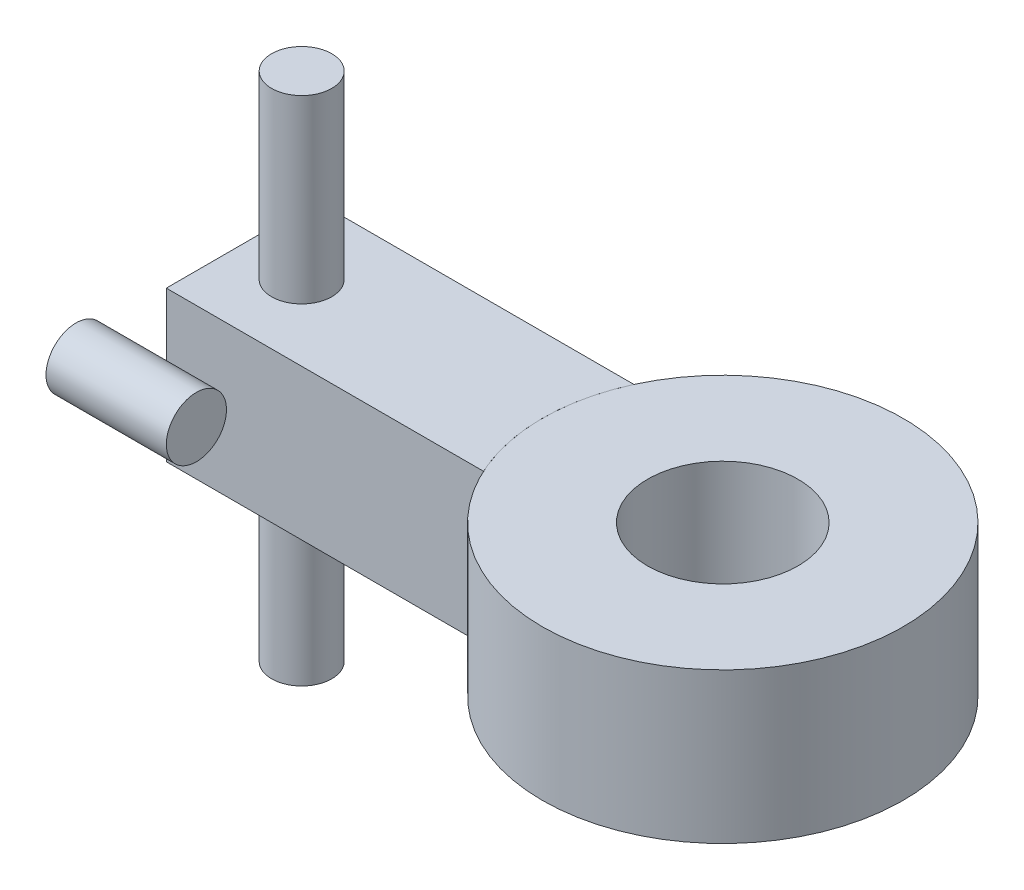
from build123d import *

# Parameters (mm, degrees)
SKETCH1_R                            = 30
SKETCH1_R_2                          = 12.5
BOSS_EXTRUDE1_DEPTH                  = 25
SKETCH3_W                            = 25
SKETCH3_H                            = 25
BOSS_EXTRUDE2_DEPTH                  = 50
BOSS_EXTRUDE2_DIRECTION_2_REACH      = 73.589
BOSS_EXTRUDE2_DIRECTION_2_END_RADIUS = 30
BOSS_EXTRUDE3_DEPTH                  = 30
BOSS_EXTRUDE3_DEPTH_BACK             = 55
SKETCH4_R                            = 5
BOSS_EXTRUDE4_DEPTH                  = 10
BOSS_EXTRUDE4_DEPTH_BACK             = 10
SKETCH5_R                            = 5


with BuildPart() as part:
    # Sketch1 → Boss-Extrude1 (new body)
    with BuildSketch(Plane(origin=(0, 0, 0), x_dir=(1, 0, 0), z_dir=(0, 1, 0))):
        Circle(SKETCH1_R)
        Circle(SKETCH1_R_2, mode=Mode.SUBTRACT)
    extrude(amount=BOSS_EXTRUDE1_DEPTH)


with BuildPart() as body_2:
    # Sketch3 → Boss-Extrude2 (new body)
    with BuildSketch(Plane.ZY.offset(30)):
        with Locations((0, 12.5)):
            Rectangle(SKETCH3_W, SKETCH3_H)
    extrude(amount=BOSS_EXTRUDE2_DEPTH)

    # Boss-Extrude2 direction 2: up to this cylinder (the profile starts outside it)
    boss_extrude2_direction_2_end = Plane(origin=(0, 12.5, 0), z_dir=(0, -1, 0)) * Cylinder(BOSS_EXTRUDE2_DIRECTION_2_END_RADIUS, 208.178, mode=Mode.PRIVATE)
    # Sketch3 → Boss-Extrude2 direction 2 (add, up to the surface)
    with BuildSketch(Plane.ZY.offset(30), mode=Mode.PRIVATE) as boss_extrude2_direction_2_sk1:
        with Locations((0, 12.5)):
            Rectangle(SKETCH3_W, SKETCH3_H)
    boss_extrude2_direction_2_tool1 = extrude(boss_extrude2_direction_2_sk1.sketch, amount=-BOSS_EXTRUDE2_DIRECTION_2_REACH, mode=Mode.PRIVATE) - boss_extrude2_direction_2_end
    add(boss_extrude2_direction_2_tool1.solids().sort_by_distance((-30, 12.5, 0))[0])
    add(boss_extrude2_direction_2_tool1.solids().sort_by_distance((-30, 12.5, 0))[1])

    # Sketch4 → Boss-Extrude3 (add, two sides: drawn at the far end of the back side and taken through both)
    with BuildSketch(Plane.XZ.offset(-BOSS_EXTRUDE3_DEPTH_BACK)):
        with Locations((-70, 0)):
            Circle(SKETCH4_R)
    extrude(amount=BOSS_EXTRUDE3_DEPTH + BOSS_EXTRUDE3_DEPTH_BACK)


with BuildPart() as body_3:
    # Sketch5 → Boss-Extrude4 (new, two sides: drawn at the far end of the back side and taken through both)
    with BuildSketch(Plane.ZY.offset(80).offset(-BOSS_EXTRUDE4_DEPTH_BACK)):
        with Locations((17.5, 12.5)):
            Circle(SKETCH5_R)
    extrude(amount=BOSS_EXTRUDE4_DEPTH + BOSS_EXTRUDE4_DEPTH_BACK)


solid = Compound([part.part, body_2.part, body_3.part])
